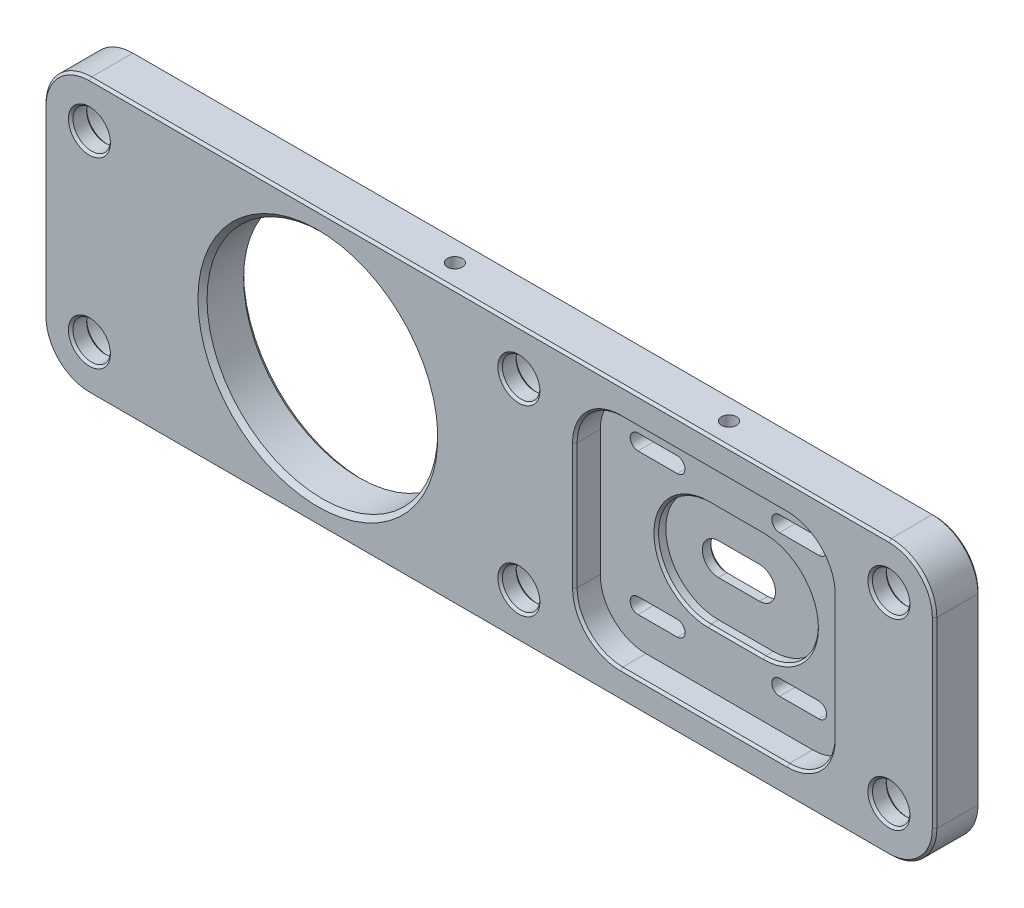
from build123d import *

# Parameters (mm, degrees)
SKICA1_W                  = 195
SKICA1_H                  = 60
P_IDAT_VYSUNUT_M1_DEPTH   = 10
ODEBRAT_VYSUNUT_M1_DEPTH  = 10
ODEBRAT_VYSUNUT_M3_DEPTH  = 2
SKICA6_R                  = 25.25
ODEBRAT_VYSUNUT_M5_DEPTH  = 10
SKICA8_W                  = 56.5
SKICA8_H                  = 47.5
ODEBRAT_VYSUNUT_M7_DEPTH  = 5.57
ODEBRAT_VYSUNUT_M8_DEPTH  = 2.1
ZKOSEN_2_SIZE             = 1
ZKOSEN_4_SIZE             = 0.5
ZAOBLIT2_R                = 10
SKICA12_R                 = 4.1
ODEBRAT_VYSUNUT_M10_DEPTH = 10
SKICA13_R                 = 7.5
ODEBRAT_VYSUNUT_M11_DEPTH = 6
ZKOSEN_6_SIZE             = 0.5
ZAOBLIT4_R                = 10
ZKOSEN_7_SIZE             = 0.5
ZKOSEN_8_SIZE             = 0.5
M4_Z_VIT2_D               = 3.3
M4_Z_VIT2_DEPTH           = 10
M4_Z_VIT2_TIP             = 0.991420021


with BuildPart() as part:
    # Skica1 → Přidat vysunutím1 (new body)
    with BuildSketch(Plane.XY):
        with Locations((97.5, 30)):
            Rectangle(SKICA1_W, SKICA1_H)
    extrude(amount=P_IDAT_VYSUNUT_M1_DEPTH)

    # Skica2 → Odebrat vysunutím1 (cut)
    with BuildSketch(Plane.XY.offset(10)):
        with BuildLine():
            Line((133.1, 43.8), (124.5, 43.8))
            ThreePointArc((124.5, 43.8), (122.8, 45.5), (124.5, 47.2))
            Line((124.5, 47.2), (133.1, 47.2))
            ThreePointArc((133.1, 47.2), (134.8, 45.5), (133.1, 43.8))
        make_face()
        with BuildLine():
            Line((164.1, 43.8), (155.5, 43.8))
            ThreePointArc((155.5, 43.8), (153.8, 45.5), (155.5, 47.2))
            Line((155.5, 47.2), (164.1, 47.2))
            ThreePointArc((164.1, 47.2), (165.8, 45.5), (164.1, 43.8))
        make_face()
        with BuildLine():
            Line((133.1, 16.2), (124.5, 16.2))
            ThreePointArc((124.5, 16.2), (122.8, 14.5), (124.5, 12.8))
            Line((124.5, 12.8), (133.1, 12.8))
            ThreePointArc((133.1, 12.8), (134.8, 14.5), (133.1, 16.2))
        make_face()
        with BuildLine():
            Line((164.1, 16.2), (155.5, 16.2))
            ThreePointArc((155.5, 16.2), (153.8, 14.5), (155.5, 12.8))
            Line((155.5, 12.8), (164.1, 12.8))
            ThreePointArc((164.1, 12.8), (165.8, 14.5), (164.1, 16.2))
        make_face()
        with BuildLine():
            Line((149, 26.5), (140, 26.5))
            ThreePointArc((140, 26.5), (136.5, 30), (140, 33.5))
            Line((140, 33.5), (149, 33.5))
            ThreePointArc((149, 33.5), (152.5, 30), (149, 26.5))
        make_face()
    extrude(amount=-ODEBRAT_VYSUNUT_M1_DEPTH, mode=Mode.SUBTRACT)

    # Skica5 → Odebrat vysunutím3 (cut)
    with BuildSketch(Plane.XY.offset(10)):
        with BuildLine():
            Line((148, 19), (140, 19))
            ThreePointArc((140, 19), (129, 30), (140, 41))
            Line((140, 41), (148, 41))
            ThreePointArc((148, 41), (159, 30), (148, 19))
        make_face()
    extrude(amount=-ODEBRAT_VYSUNUT_M3_DEPTH, mode=Mode.SUBTRACT)

    # Skica6 → Odebrat vysunutím5 (cut)
    with BuildSketch(Plane(origin=(0, 0, 0), x_dir=(-1, 0, 0), z_dir=(0, 0, -1))):
        with Locations((-60, 30)):
            Circle(SKICA6_R)
    extrude(amount=-ODEBRAT_VYSUNUT_M5_DEPTH, mode=Mode.SUBTRACT)

    # Skica8 → Odebrat vysunutím7 (cut)
    with BuildSketch(Plane.XY.offset(10)):
        with Locations((144.5, 30)):
            Rectangle(SKICA8_W, SKICA8_H)
    extrude(amount=-ODEBRAT_VYSUNUT_M7_DEPTH, mode=Mode.SUBTRACT)

    # Skica9 → Odebrat vysunutím8 (cut)
    with BuildSketch(Plane.XY.offset(4.43)):
        with BuildLine():
            Line((152, 18.5), (140, 18.5))
            ThreePointArc((140, 18.5), (128.5, 30), (140, 41.5))
            Line((140, 41.5), (152, 41.5))
            ThreePointArc((152, 41.5), (163.5, 30), (152, 18.5))
        make_face()
    extrude(amount=-ODEBRAT_VYSUNUT_M8_DEPTH, mode=Mode.SUBTRACT)

    # Zkosení2
    zkosen_2_edges = [part.edges().sort_by_distance(p)[0] for p in [
        (85.25, 30, 0),
        (85.25, 30, 10),
    ]]
    chamfer(zkosen_2_edges, length=ZKOSEN_2_SIZE)

    # Zkosení4
    zkosen_4_edges = [part.edges().sort_by_distance(p)[0] for p in [
        (144.5, 33.5, 0),
        (136.5, 30, 0),
        (144.5, 26.5, 0),
        (152.5, 30, 0),
    ]]
    chamfer(zkosen_4_edges, length=ZKOSEN_4_SIZE)

    # Zaoblit2
    zaoblit2_edges = [part.edges().sort_by_distance(p)[0] for p in [
        (0, 60, 5),
        (195, 60, 5),
        (195, 0, 5),
        (0, 0, 5),
    ]]
    fillet(zaoblit2_edges, radius=ZAOBLIT2_R)

    # Skica12 → Odebrat vysunutím10 (cut)
    with BuildSketch(Plane(origin=(0, 0, 0), x_dir=(-1, 0, 0), z_dir=(0, 0, -1))):
        with Locations((-10, 50)):
            Circle(SKICA12_R)
        with Locations((-10, 10)):
            Circle(SKICA12_R)
        with Locations((-104, 50)):
            Circle(SKICA12_R)
        with Locations((-104, 10)):
            Circle(SKICA12_R)
        with Locations((-185, 50)):
            Circle(SKICA12_R)
        with Locations((-185, 10)):
            Circle(SKICA12_R)
    extrude(amount=-ODEBRAT_VYSUNUT_M10_DEPTH, mode=Mode.SUBTRACT)

    # Skica13 → Odebrat vysunutím11 (cut)
    with BuildSketch(Plane(origin=(0, 0, 0), x_dir=(-1, 0, 0), z_dir=(0, 0, -1))):
        with Locations((-10, 50)):
            Circle(SKICA13_R)
        with Locations((-10, 10)):
            Circle(SKICA13_R)
        with Locations((-104, 50)):
            Circle(SKICA13_R)
        with Locations((-104, 10)):
            Circle(SKICA13_R)
        with Locations((-185, 50)):
            Circle(SKICA13_R)
        with Locations((-185, 10)):
            Circle(SKICA13_R)
    extrude(amount=-ODEBRAT_VYSUNUT_M11_DEPTH, mode=Mode.SUBTRACT)

    # Zkosení6
    zkosen_6_edges = [part.edges().sort_by_distance(p)[0] for p in [
        (189.1, 50, 10),
        (108.1, 10, 10),
        (108.1, 50, 10),
        (14.1, 10, 10),
        (189.1, 10, 10),
        (14.1, 50, 10),
        (192.5, 50, 0),
        (189.1, 50, 6),
        (111.5, 10, 0),
        (108.1, 10, 6),
        (111.5, 50, 0),
        (108.1, 50, 6),
        (17.5, 10, 0),
        (14.1, 10, 6),
        (192.5, 10, 0),
        (189.1, 10, 6),
        (17.5, 50, 0),
        (14.1, 50, 6),
    ]]
    chamfer(zkosen_6_edges, length=ZKOSEN_6_SIZE)

    # Zaoblit4
    zaoblit4_edges = [part.edges().sort_by_distance(p)[0] for p in [
        (116.25, 6.25, 7.215),
        (116.25, 53.75, 7.215),
        (172.75, 53.75, 7.215),
        (172.75, 6.25, 7.215),
    ]]
    fillet(zaoblit4_edges, radius=ZAOBLIT4_R)

    # Zkosení7
    zkosen_7_edges = [part.edges().sort_by_distance(p)[0] for p in [
        (195, 30, 0),
        (195, 30, 10),
        (0, 30, 0),
        (97.5, 60, 0),
        (97.5, 0, 0),
        (2.928932188, 57.071067812, 0),
        (2.928932188, 2.928932188, 0),
        (192.071067812, 57.071067812, 0),
        (192.071067812, 2.928932188, 0),
        (97.5, 0, 10),
        (0, 30, 10),
        (97.5, 60, 10),
        (2.928932188, 57.071067812, 10),
        (2.928932188, 2.928932188, 10),
        (192.071067812, 57.071067812, 10),
        (192.071067812, 2.928932188, 10),
    ]]
    chamfer(zkosen_7_edges, length=ZKOSEN_7_SIZE)

    # Zkosení8
    zkosen_8_edges = [part.edges().sort_by_distance(p)[0] for p in [
        (163.5, 30, 4.43),
        (146, 41.5, 4.43),
        (128.5, 30, 4.43),
        (146, 18.5, 4.43),
        (144.5, 6.25, 10),
        (116.25, 30, 10),
        (172.75, 30, 10),
        (144.5, 53.75, 10),
        (119.178932188, 9.178932188, 10),
        (169.821067812, 9.178932188, 10),
        (169.821067812, 50.821067812, 10),
        (119.178932188, 50.821067812, 10),
    ]]
    chamfer(zkosen_8_edges, length=ZKOSEN_8_SIZE)

    # M4 závit2
    with Locations(Plane(origin=(0, 60, 0), x_dir=(1, 0, 0), z_dir=(0, 1, 0))):
        with Locations((85, -5), (145, -5)):
            Hole(M4_Z_VIT2_D / 2, depth=M4_Z_VIT2_DEPTH)
            with Locations((0, 0, -(M4_Z_VIT2_DEPTH + M4_Z_VIT2_TIP / 2))):  # 118° drill point
                Cone(0, M4_Z_VIT2_D / 2, M4_Z_VIT2_TIP, mode=Mode.SUBTRACT)


solid = part.part
